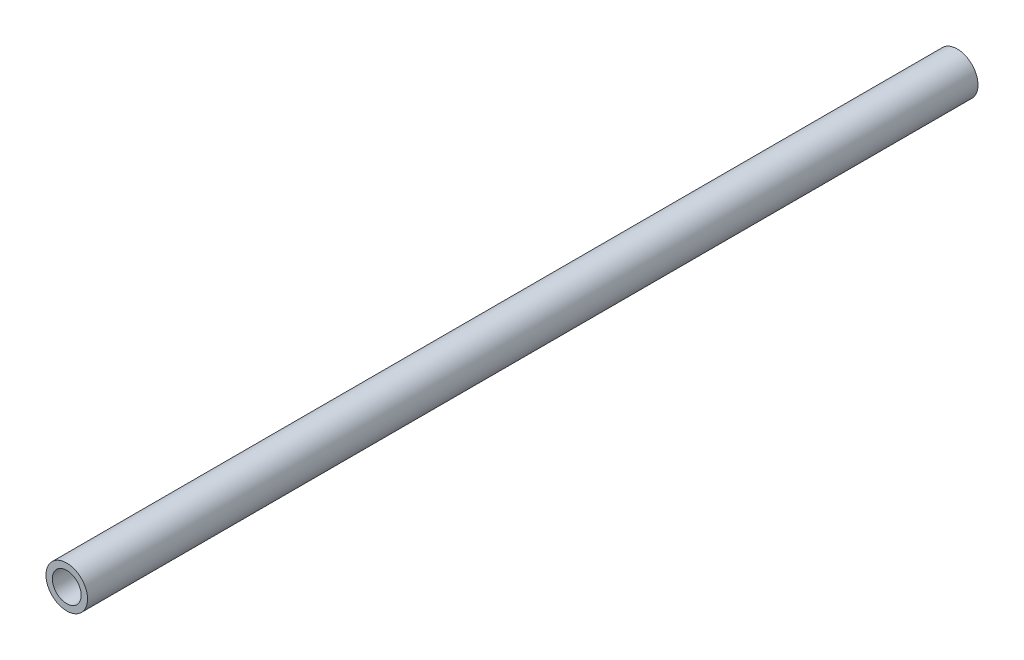
from build123d import *

# Parameters (mm, degrees)
BOSS_EXTRUDE1_DEPTH      = 97.917
BOSS_EXTRUDE1_DEPTH_BACK = 97.917
SKETCH3_R                = 4.572
SKETCH3_R_2              = 3.175


with BuildPart() as part:
    # Sketch3 → Boss-Extrude1 (new, two sides: drawn at the far end of the back side and taken through both)
    with BuildSketch(Plane.XY.offset(-BOSS_EXTRUDE1_DEPTH_BACK)):
        Circle(SKETCH3_R)
        Circle(SKETCH3_R_2, mode=Mode.SUBTRACT)
    extrude(amount=BOSS_EXTRUDE1_DEPTH + BOSS_EXTRUDE1_DEPTH_BACK)


solid = part.part
